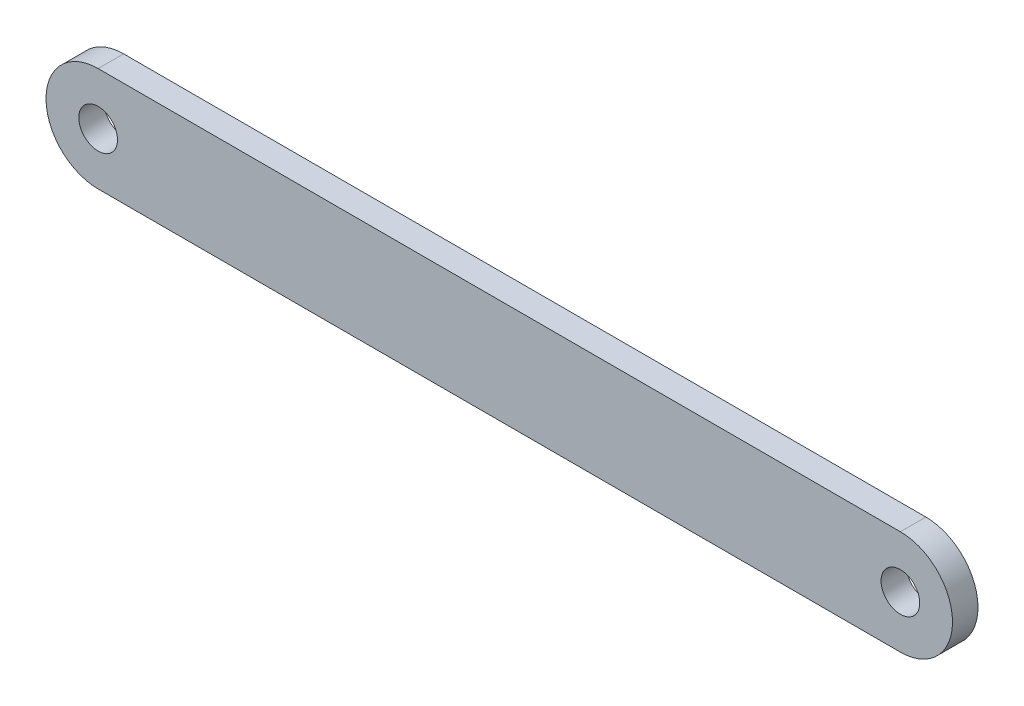
from build123d import *

# Parameters (mm, degrees)
SKETCH1_R           = 2.413
BOSS_EXTRUDE1_DEPTH = 3.175


with BuildPart() as part:
    # Sketch1 → Boss-Extrude1 (new body)
    with BuildSketch(Plane.XY):
        with BuildLine():
            Line((-50, 6.5), (50, 6.5))
            ThreePointArc((50, 6.5), (56.5, 0), (50, -6.5))
            Line((50, -6.5), (-50, -6.5))
            ThreePointArc((-50, -6.5), (-56.5, 0), (-50, 6.5))
        make_face()
        with Locations((-50, 0)):
            Circle(SKETCH1_R, mode=Mode.SUBTRACT)
        with Locations((50, 0)):
            Circle(SKETCH1_R, mode=Mode.SUBTRACT)
    extrude(amount=BOSS_EXTRUDE1_DEPTH)


solid = part.part
